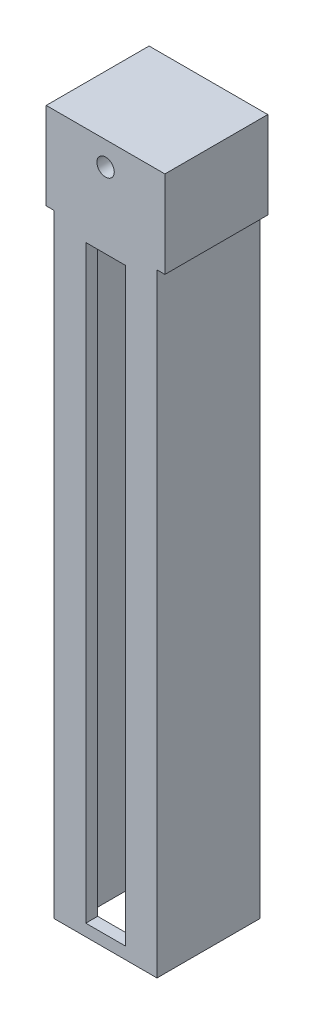
from build123d import *

# Parameters (mm, degrees)
SKETCH1_W           = 26
SKETCH1_H           = 26
BOSS_EXTRUDE1_DEPTH = 155
SHELL1_T            = -3
SKETCH2_W           = 10
SKETCH2_H           = 149
CUT_EXTRUDE1_DEPTH  = 3
SKETCH3_W           = 30
SKETCH3_H           = 26
BOSS_EXTRUDE2_DEPTH = 22
SKETCH4_R           = 2.2
CUT_EXTRUDE2_DEPTH  = 180.52715672


with BuildPart() as part:
    # Sketch1 → Boss-Extrude1 (new body)
    with BuildSketch(Plane(origin=(0, 0, 0), x_dir=(1, 0, 0), z_dir=(0, 1, 0))):
        Rectangle(SKETCH1_W, SKETCH1_H)
    extrude(amount=BOSS_EXTRUDE1_DEPTH)

    # Shell1
    shell1_openings = [part.faces().sort_by_distance(p)[0] for p in [
        (0, 155, 0),
        (0, 0, 0),
    ]]
    offset(amount=SHELL1_T, openings=shell1_openings, kind=Kind.INTERSECTION)

    # Sketch2 → Cut-Extrude1 (cut)
    with BuildSketch(Plane.XY.offset(13)):
        with Locations((0, 77.5)):
            Rectangle(SKETCH2_W, SKETCH2_H)
    extrude(amount=-CUT_EXTRUDE1_DEPTH, mode=Mode.SUBTRACT)

    # Sketch3 → Boss-Extrude2 (add)
    with BuildSketch(Plane(origin=(0, 155, 0), x_dir=(1, 0, 0), z_dir=(0, 1, 0))):
        Rectangle(SKETCH3_W, SKETCH3_H)
    extrude(amount=BOSS_EXTRUDE2_DEPTH)

    # Sketch4 → Cut-Extrude2 (cut, through all)
    with BuildSketch(Plane.XY.offset(13)):
        with Locations((0, 171)):
            Circle(SKETCH4_R)
    extrude(amount=-CUT_EXTRUDE2_DEPTH, mode=Mode.SUBTRACT)


solid = part.part
